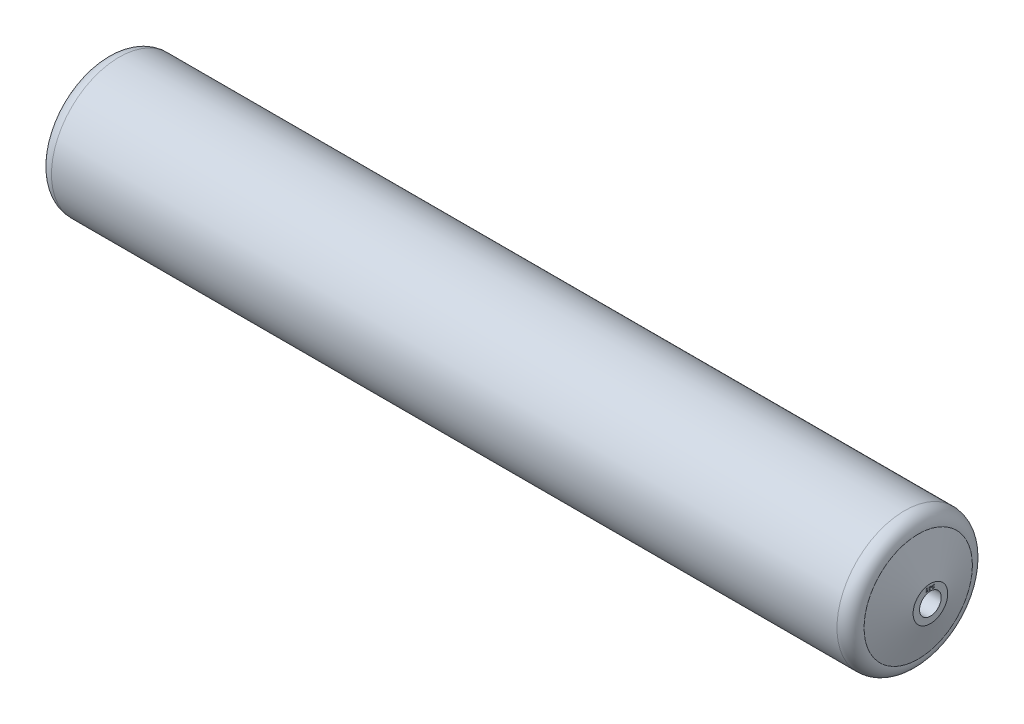
from build123d import *

# Parameters (mm, degrees)
ENL_V_MAT_EXTRU_1_DEPTH       = 0.1
BOSS_EXTRU_1_DEPTH            = 0.1
ENL_V_MAT_EXTRU_2_DEPTH       = 0.1
ENL_V_MAT_EXTRU_3_DEPTH       = 0.1
DIAM_TRE_DU_PER_AGE_8_0_8_1_D = 8


with BuildPart() as part:
    # Esquisse1 → Révolution1 (revolve)
    with BuildSketch(Plane.XY, mode=Mode.PRIVATE) as r_volution1_sk:
        with BuildLine():
            Line((-154.5, 6.4), (-154.5, 0))
            Line((-154.5, 0), (154.5, 0))
            Line((154.5, 0), (154.5, 6.4))
            Line((154.5, 6.4), (150, 20))
            ThreePointArc((150, 20), (148.535533906, 23.535533906), (145, 25))
            Line((145, 25), (-145, 25))
            ThreePointArc((-145, 25), (-148.535533906, 23.535533906), (-150, 20))
            Line((-150, 20), (-154.5, 6.4))
        make_face()
    revolve(r_volution1_sk.sketch.rotate(Axis((-154.5, 0, 0), (1, 0, 0)), 270), axis=Axis((-154.5, 0, 0), (1, 0, 0)))

    # Esquisse2 → Enlèv. mat.-Extru.1 (cut)
    with BuildSketch(Plane(origin=(154.5, 0, 0), x_dir=(0, 0, -1), z_dir=(1, 0, 0))):
        with BuildLine():
            Line((-0.220970869, 4.84375), (0.016600829, 4.84375))
            ThreePointArc((0.016600829, 4.84375), (0.407225829, 5.234375), (0.016600829, 5.625))
            Line((0.016600829, 5.625), (-0.533470869, 5.625))
            Line((-0.533470869, 5.625), (-0.533470869, 4.375))
            Line((-0.533470869, 4.375), (-0.220970869, 4.375))
            Line((-0.220970869, 4.375), (-0.220970869, 4.84375))
        make_face()
    extrude(amount=-ENL_V_MAT_EXTRU_1_DEPTH, mode=Mode.SUBTRACT)

    # Esquisse3 → Boss.-Extru.1 (add)
    with BuildSketch(Plane(origin=(154.4, 0, 0), x_dir=(0, 0, -1), z_dir=(1, 0, 0))):
        with BuildLine():
            Line((-0.220970869, 5.390625), (0.016600773, 5.390625))
            ThreePointArc((0.016600773, 5.390625), (0.172850773, 5.234375), (0.016600773, 5.078125))
            Line((0.016600773, 5.078125), (-0.220970869, 5.078125))
            Line((-0.220970869, 5.078125), (-0.220970869, 5.390625))
        make_face()
    extrude(amount=BOSS_EXTRU_1_DEPTH)

    # Esquisse4 → Enlèv. mat.-Extru.2 (cut)
    with BuildSketch(Plane(origin=(154.5, 0, 0), x_dir=(0, 0, -1), z_dir=(1, 0, 0))):
        Polygon((-1.001554062, 5.15625), (-1.314054062, 5.15625), (-1.314054062, 5.625), (-1.626554062, 5.625), (-1.626554062, 4.375), (-1.314054062, 4.375), (-1.314054062, 4.84375), (-1.001554062, 4.84375), (-1.001554062, 4.375), (-0.689054062, 4.375), (-0.689054062, 5.625), (-1.001554062, 5.625), align=None)
    extrude(amount=-ENL_V_MAT_EXTRU_2_DEPTH, mode=Mode.SUBTRACT)

    # Esquisse5 → Enlèv. mat.-Extru.3 (cut)
    with BuildSketch(Plane(origin=(154.5, 0, 0), x_dir=(0, 0, -1), z_dir=(1, 0, 0))):
        with BuildLine():
            ThreePointArc((1.626553937, 5.441941613), (0.5596125, 5), (1.626554062, 4.558058262))
            add(Edge.make_bspline(
                [(1.405583193, 4.779029131), (1.479240149, 4.705372175), (1.552897105, 4.631715218), (1.626554062, 4.558058262)],
                knots=[0, 0, 0, 0, 1, 1, 1, 1], degree=3))
            ThreePointArc((1.405583193, 4.779029131), (0.872112323, 5), (1.405583193, 5.220970869))
            add(Edge.make_bspline(
                [(1.626553937, 5.441941613), (1.552897022, 5.368284699), (1.479240107, 5.294627784), (1.405583193, 5.220970869)],
                knots=[0, 0, 0, 0, 1, 1, 1, 1], degree=3))
        make_face()
    extrude(amount=-ENL_V_MAT_EXTRU_3_DEPTH, mode=Mode.SUBTRACT)

    # Diamètre du perçage Ø8.0 (8)1 (through all)
    with Locations(Plane.ZY.offset(154.5)):
        with Locations((0, 0)):
            Hole(DIAM_TRE_DU_PER_AGE_8_0_8_1_D / 2)


solid = part.part
